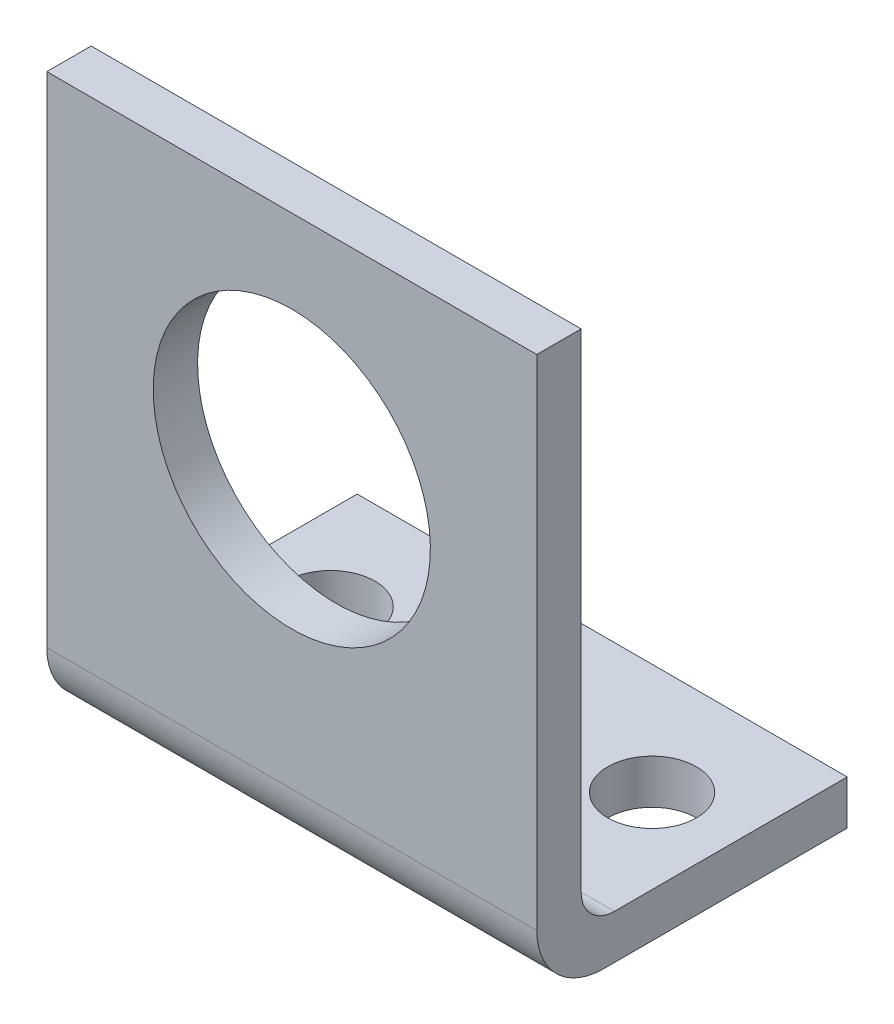
from build123d import *

# Parameters (mm, degrees)
BOSS_EXTRU_1_DEPTH      = 22.1
ESQUISSE2_R             = 2
ENL_V_MAT_EXTRU_1_DEPTH = 36.166176932
ESQUISSE3_R             = 6.25
ENL_V_MAT_EXTRU_2_DEPTH = 36.814242977


with BuildPart() as part:
    # Esquisse1 → Boss.-Extru.1 (new body)
    with BuildSketch(Plane(origin=(0, 0, 0), x_dir=(0, 0, -1), z_dir=(1, 0, 0))):
        with BuildLine():
            Line((0, 25.5), (0, 3))
            ThreePointArc((0, 3), (0.878679656, 0.878679656), (3, 0))
            Line((3, 0), (14, 0))
            Line((14, 0), (14, 2))
            Line((14, 2), (3.5, 2))
            ThreePointArc((3.5, 2), (2.439339828, 2.439339828), (2, 3.5))
            Line((2, 3.5), (2, 25.5))
            Line((2, 25.5), (0, 25.5))
        make_face()
    extrude(amount=BOSS_EXTRU_1_DEPTH)

    # Esquisse2 → Enlèv. mat.-Extru.1 (cut, through all)
    with BuildSketch(Plane(origin=(0, 2, 0), x_dir=(1, 0, 0), z_dir=(0, 1, 0))):
        with Locations(Location((3.8, 9, 0), (0, 0, 270))):
            Circle(ESQUISSE2_R)
        with Locations(Location((18.3, 9, 0), (0, 0, 270))):
            Circle(ESQUISSE2_R)
    extrude(amount=-ENL_V_MAT_EXTRU_1_DEPTH, mode=Mode.SUBTRACT)

    # Esquisse3 → Enlèv. mat.-Extru.2 (cut, through all)
    with BuildSketch(Plane(origin=(0, 0, -2), x_dir=(-1, 0, 0), z_dir=(0, 0, -1))):
        with Locations(Location((-11.05, 15.5, 0), (0, 0, 90))):
            Circle(ESQUISSE3_R)
    extrude(amount=-ENL_V_MAT_EXTRU_2_DEPTH, mode=Mode.SUBTRACT)


solid = part.part
